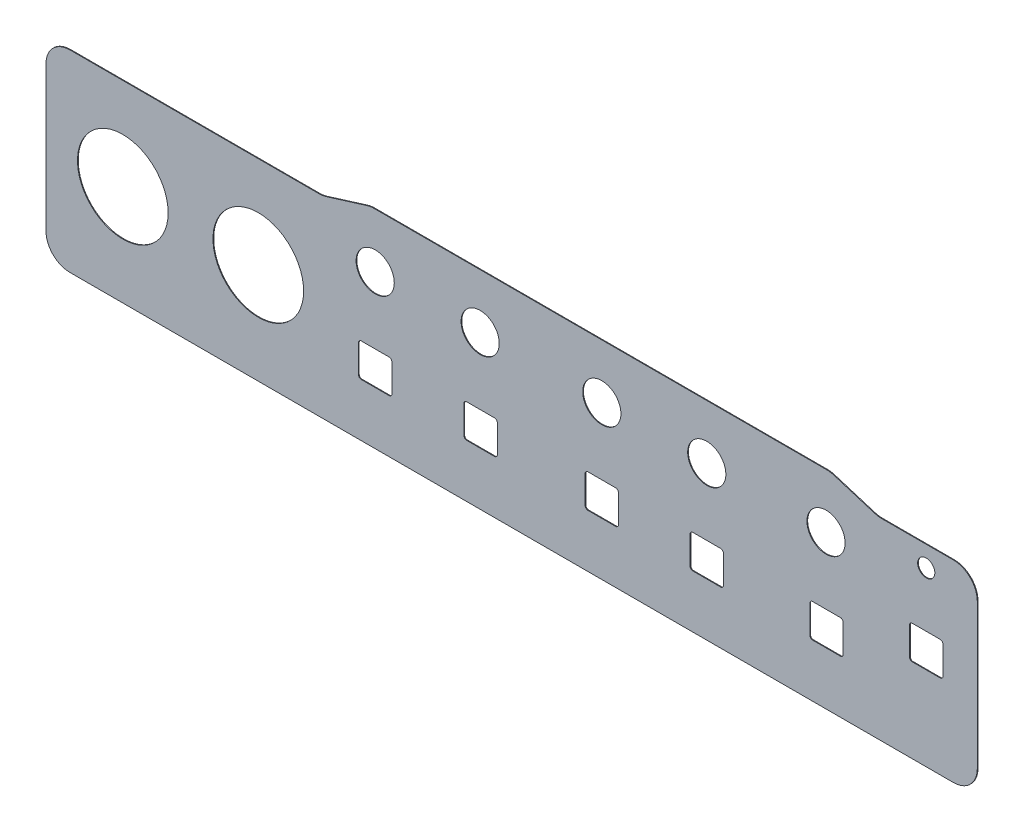
from build123d import *

# Parameters (mm, degrees)
PRINTED_FILM_START              = 14.65
PRINTED_FILM_DEPTH              = 0.15
OPENING_BNC_CHANNEL_0_START     = 14.9
OPENING_BNC_CHANNEL_0_PROFILE_R = 9.5
OPENING_BNC_CHANNEL_0_DEPTH     = 0.35
OPENING_BNC_CHANNEL_1_START     = 14.9
OPENING_BNC_CHANNEL_1_PROFILE_R = 9.5
OPENING_BNC_CHANNEL_1_DEPTH     = 0.35
OPENING_LED_RUN_START           = 14.9
OPENING_LED_RUN_PROFILE_R       = 1.8
OPENING_LED_RUN_DEPTH           = 0.35
OPENING_FUNC_START              = 14.9
OPENING_FUNC_PROFILE_R          = 4
OPENING_FUNC_DEPTH              = 0.35
OPENING_TRG_MODE_START          = 14.9
OPENING_TRG_MODE_DEPTH          = 0.35
OPENING_CURSOR_START            = 14.9
OPENING_CURSOR_DEPTH            = 0.35
OPENING_EN_CH1_START            = 14.9
OPENING_EN_CH1_DEPTH            = 0.35
OPENING_TRG_START               = 14.9
OPENING_TRG_PROFILE_R           = 4
OPENING_TRG_DEPTH               = 0.35
OPENING_TIME_START              = 14.9
OPENING_TIME_PROFILE_R          = 4
OPENING_TIME_DEPTH              = 0.35
OPENING_SET_CH1_START           = 14.9
OPENING_SET_CH1_PROFILE_R       = 4
OPENING_SET_CH1_DEPTH           = 0.35
OPENING_SET_CH0_START           = 14.9
OPENING_SET_CH0_PROFILE_R       = 4
OPENING_SET_CH0_DEPTH           = 0.35
OPENING_RUN_STOP_START          = 14.9
OPENING_RUN_STOP_DEPTH          = 0.35
OPENING_MENU_BACK_START         = 14.9
OPENING_MENU_BACK_DEPTH         = 0.35
OPENING_EN_CH0_START            = 14.9
OPENING_EN_CH0_DEPTH            = 0.35


with BuildPart() as part:
    # Printed_film_profile → Printed_film (new body)
    with BuildSketch(Plane.XY.offset(PRINTED_FILM_START)):
        with BuildLine():
            Line((2.4, -6.6), (187.6, -6.6))
            ThreePointArc((187.6, -6.6), (191.135533906, -5.135533906), (192.6, -1.6))
            Line((192.6, -1.6), (192.6, 28.8))
            ThreePointArc((192.6, 28.8), (191.135533906, 32.335533906), (187.6, 33.8))
            Line((187.6, 33.8), (172.557224923, 33.8))
            ThreePointArc((172.557224923, 33.8), (171.808537122, 33.856371113), (171.076731067, 34.024213369))
            Line((171.076731067, 34.024213369), (162.523268933, 36.675786631))
            ThreePointArc((162.523268933, 36.675786631), (161.791462878, 36.843628887), (161.042775077, 36.9))
            Line((161.042775077, 36.9), (66.157224923, 36.9))
            ThreePointArc((66.157224923, 36.9), (65.408537122, 36.843628887), (64.676731067, 36.675786631))
            Line((64.676731067, 36.675786631), (56.123268933, 34.024213369))
            ThreePointArc((56.123268933, 34.024213369), (55.391462878, 33.856371113), (54.642775077, 33.8))
            Line((54.642775077, 33.8), (2.4, 33.8))
            ThreePointArc((2.4, 33.8), (-1.135533906, 32.335533906), (-2.6, 28.8))
            Line((-2.6, 28.8), (-2.6, -1.6))
            ThreePointArc((-2.6, -1.6), (-1.135533906, -5.135533906), (2.4, -6.6))
        make_face()
    extrude(amount=PRINTED_FILM_DEPTH)

    # Opening_BNC_Channel_0_profile → Opening_BNC_Channel_0 (cut)
    with BuildSketch(Plane.XY.offset(OPENING_BNC_CHANNEL_0_START)):
        with Locations((13.5, 14.5)):
            Circle(OPENING_BNC_CHANNEL_0_PROFILE_R)
    extrude(amount=-OPENING_BNC_CHANNEL_0_DEPTH, mode=Mode.SUBTRACT)

    # Opening_BNC_Channel_1_profile → Opening_BNC_Channel_1 (cut)
    with BuildSketch(Plane.XY.offset(OPENING_BNC_CHANNEL_1_START)):
        with Locations((41.9, 14.5)):
            Circle(OPENING_BNC_CHANNEL_1_PROFILE_R)
    extrude(amount=-OPENING_BNC_CHANNEL_1_DEPTH, mode=Mode.SUBTRACT)

    # Opening_LED_RUN_profile → Opening_LED_RUN (cut)
    with BuildSketch(Plane.XY.offset(OPENING_LED_RUN_START)):
        with Locations((181.9, 29.5)):
            Circle(OPENING_LED_RUN_PROFILE_R)
    extrude(amount=-OPENING_LED_RUN_DEPTH, mode=Mode.SUBTRACT)

    # Opening_FUNC_profile → Opening_FUNC (cut)
    with BuildSketch(Plane.XY.offset(OPENING_FUNC_START)):
        with Locations((160.9, 25.5)):
            Circle(OPENING_FUNC_PROFILE_R)
    extrude(amount=-OPENING_FUNC_DEPTH, mode=Mode.SUBTRACT)

    # Opening_TRG_MODE_profile → Opening_TRG_MODE (cut)
    with BuildSketch(Plane.XY.offset(OPENING_TRG_MODE_START)):
        with BuildLine():
            Line((133, 4.5), (138.8, 4.5))
            ThreePointArc((138.8, 4.5), (139.224264069, 4.675735931), (139.4, 5.1))
            Line((139.4, 5.1), (139.4, 10.9))
            ThreePointArc((139.4, 10.9), (139.224264069, 11.324264069), (138.8, 11.5))
            Line((138.8, 11.5), (133, 11.5))
            ThreePointArc((133, 11.5), (132.575735931, 11.324264069), (132.4, 10.9))
            Line((132.4, 10.9), (132.4, 5.1))
            ThreePointArc((132.4, 5.1), (132.575735931, 4.675735931), (133, 4.5))
        make_face()
    extrude(amount=-OPENING_TRG_MODE_DEPTH, mode=Mode.SUBTRACT)

    # Opening_CURSOR_profile → Opening_CURSOR (cut)
    with BuildSketch(Plane.XY.offset(OPENING_CURSOR_START)):
        with BuildLine():
            Line((111, 4.5), (116.8, 4.5))
            ThreePointArc((116.8, 4.5), (117.224264069, 4.675735931), (117.4, 5.1))
            Line((117.4, 5.1), (117.4, 10.9))
            ThreePointArc((117.4, 10.9), (117.224264069, 11.324264069), (116.8, 11.5))
            Line((116.8, 11.5), (111, 11.5))
            ThreePointArc((111, 11.5), (110.575735931, 11.324264069), (110.4, 10.9))
            Line((110.4, 10.9), (110.4, 5.1))
            ThreePointArc((110.4, 5.1), (110.575735931, 4.675735931), (111, 4.5))
        make_face()
    extrude(amount=-OPENING_CURSOR_DEPTH, mode=Mode.SUBTRACT)

    # Opening_EN_CH1_profile → Opening_EN_CH1 (cut)
    with BuildSketch(Plane.XY.offset(OPENING_EN_CH1_START)):
        with BuildLine():
            Line((85.6, 4.5), (91.4, 4.5))
            ThreePointArc((91.4, 4.5), (91.824264069, 4.675735931), (92, 5.1))
            Line((92, 5.1), (92, 10.9))
            ThreePointArc((92, 10.9), (91.824264069, 11.324264069), (91.4, 11.5))
            Line((91.4, 11.5), (85.6, 11.5))
            ThreePointArc((85.6, 11.5), (85.175735931, 11.324264069), (85, 10.9))
            Line((85, 10.9), (85, 5.1))
            ThreePointArc((85, 5.1), (85.175735931, 4.675735931), (85.6, 4.5))
        make_face()
    extrude(amount=-OPENING_EN_CH1_DEPTH, mode=Mode.SUBTRACT)

    # Opening_TRG_profile → Opening_TRG (cut)
    with BuildSketch(Plane.XY.offset(OPENING_TRG_START)):
        with Locations((135.9, 25.5)):
            Circle(OPENING_TRG_PROFILE_R)
    extrude(amount=-OPENING_TRG_DEPTH, mode=Mode.SUBTRACT)

    # Opening_TIME_profile → Opening_TIME (cut)
    with BuildSketch(Plane.XY.offset(OPENING_TIME_START)):
        with Locations((113.9, 25.5)):
            Circle(OPENING_TIME_PROFILE_R)
    extrude(amount=-OPENING_TIME_DEPTH, mode=Mode.SUBTRACT)

    # Opening_SET_CH1_profile → Opening_SET_CH1 (cut)
    with BuildSketch(Plane.XY.offset(OPENING_SET_CH1_START)):
        with Locations((88.4, 25.5)):
            Circle(OPENING_SET_CH1_PROFILE_R)
    extrude(amount=-OPENING_SET_CH1_DEPTH, mode=Mode.SUBTRACT)

    # Opening_SET_CH0_profile → Opening_SET_CH0 (cut)
    with BuildSketch(Plane.XY.offset(OPENING_SET_CH0_START)):
        with Locations((66.4, 25.5)):
            Circle(OPENING_SET_CH0_PROFILE_R)
    extrude(amount=-OPENING_SET_CH0_DEPTH, mode=Mode.SUBTRACT)

    # Opening_RUN_STOP_profile → Opening_RUN_STOP (cut)
    with BuildSketch(Plane.XY.offset(OPENING_RUN_STOP_START)):
        with BuildLine():
            Line((179, 11), (184.8, 11))
            ThreePointArc((184.8, 11), (185.224264069, 11.175735931), (185.4, 11.6))
            Line((185.4, 11.6), (185.4, 17.4))
            ThreePointArc((185.4, 17.4), (185.224264069, 17.824264069), (184.8, 18))
            Line((184.8, 18), (179, 18))
            ThreePointArc((179, 18), (178.575735931, 17.824264069), (178.4, 17.4))
            Line((178.4, 17.4), (178.4, 11.6))
            ThreePointArc((178.4, 11.6), (178.575735931, 11.175735931), (179, 11))
        make_face()
    extrude(amount=-OPENING_RUN_STOP_DEPTH, mode=Mode.SUBTRACT)

    # Opening_MENU_BACK_profile → Opening_MENU_BACK (cut)
    with BuildSketch(Plane.XY.offset(OPENING_MENU_BACK_START)):
        with BuildLine():
            Line((158.1, 4.5), (163.9, 4.5))
            ThreePointArc((163.9, 4.5), (164.324264069, 4.675735931), (164.5, 5.1))
            Line((164.5, 5.1), (164.5, 10.9))
            ThreePointArc((164.5, 10.9), (164.324264069, 11.324264069), (163.9, 11.5))
            Line((163.9, 11.5), (158.1, 11.5))
            ThreePointArc((158.1, 11.5), (157.675735931, 11.324264069), (157.5, 10.9))
            Line((157.5, 10.9), (157.5, 5.1))
            ThreePointArc((157.5, 5.1), (157.675735931, 4.675735931), (158.1, 4.5))
        make_face()
    extrude(amount=-OPENING_MENU_BACK_DEPTH, mode=Mode.SUBTRACT)

    # Opening_EN_CH0_profile → Opening_EN_CH0 (cut)
    with BuildSketch(Plane.XY.offset(OPENING_EN_CH0_START)):
        with BuildLine():
            Line((63.5, 4.5), (69.3, 4.5))
            ThreePointArc((69.3, 4.5), (69.724264069, 4.675735931), (69.9, 5.1))
            Line((69.9, 5.1), (69.9, 10.9))
            ThreePointArc((69.9, 10.9), (69.724264069, 11.324264069), (69.3, 11.5))
            Line((69.3, 11.5), (63.5, 11.5))
            ThreePointArc((63.5, 11.5), (63.075735931, 11.324264069), (62.9, 10.9))
            Line((62.9, 10.9), (62.9, 5.1))
            ThreePointArc((62.9, 5.1), (63.075735931, 4.675735931), (63.5, 4.5))
        make_face()
    extrude(amount=-OPENING_EN_CH0_DEPTH, mode=Mode.SUBTRACT)


solid = part.part
